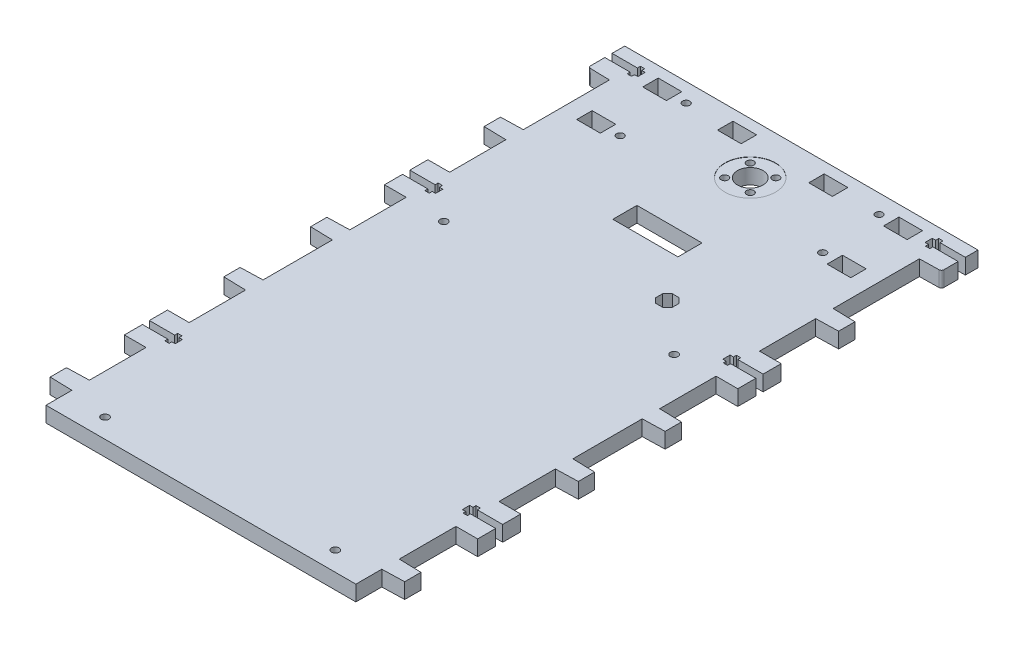
from build123d import *

# Parameters (mm, degrees)
SKETCH1_R           = 1.575
SKETCH1_R_2         = 1.5
SKETCH1_R_3         = 5.25
SKETCH1_W           = 27
SKETCH1_H           = 10
SKETCH1_W_2         = 9.8
SKETCH1_H_2         = 6.4
BOSS_EXTRUDE1_DEPTH = 6.4
SKETCH2_R           = 10.5
CUT_EXTRUDE1_DEPTH  = 0.1


with BuildPart() as part:
    # Sketch1 → Boss-Extrude1 (new body)
    with BuildSketch(Plane(origin=(0, 0, 0), x_dir=(1, 0, 0), z_dir=(0, 1, 0))):
        with BuildLine():
            Line((-8.500323666, 251.99), (138.000323666, 251.99))
            Line((138.000323666, 251.99), (138.000323666, 246.75))
            Line((138.000323666, 246.75), (127.500323666, 246.75))
            Line((127.500323666, 246.75), (127.500323666, 248))
            Line((127.500323666, 248), (125.700323666, 248))
            Line((125.700323666, 248), (125.700323666, 246.75))
            Line((125.700323666, 246.75), (124.300323666, 246.75))
            Line((124.300323666, 246.75), (124.300323666, 243.750281653))
            Line((124.300323666, 243.750281653), (125.700323666, 243.750281653))
            Line((125.700323666, 243.750281653), (125.700323666, 242.500281653))
            Line((125.700323666, 242.500281653), (127.500323666, 242.500281653))
            Line((127.500323666, 242.500281653), (127.500323666, 243.750281653))
            Line((127.500323666, 243.750281653), (138.000323666, 243.750281653))
            Line((138.000323666, 243.750281653), (138.000323666, 237.840500792))
            ThreePointArc((138.000323666, 237.840500792), (137.707887631, 237.129912233), (137, 236.830997467))
            Line((137, 236.830997467), (129, 236.670997467))
            Line((129, 236.670997467), (129, 200.950140827))
            Line((129, 200.950140827), (138.250000248, 200.700140827))
            Line((138.250000248, 200.700140827), (138.250000248, 193.950140827))
            Line((138.250000248, 193.950140827), (129, 193.700140827))
            Line((129, 193.700140827), (129, 170.369179587))
            Line((129, 170.369179587), (138, 170.369179587))
            Line((138, 170.369179587), (138, 162.868552997))
            Line((138, 162.868552997), (127.5, 162.868552997))
            Line((127.5, 162.868552997), (127.5, 164.118552997))
            Line((127.5, 164.118552997), (125.7, 164.118552997))
            Line((125.7, 164.118552997), (125.7, 162.868552997))
            Line((125.7, 162.868552997), (124.3, 162.868552997))
            Line((124.3, 162.868552997), (124.3, 159.86883465))
            Line((124.3, 159.86883465), (125.7, 159.86883465))
            Line((125.7, 159.86883465), (125.7, 158.61883465))
            Line((125.7, 158.61883465), (127.500521899, 158.61883465))
            Line((127.500521899, 158.61883465), (127.500521899, 159.86883465))
            Line((127.500521899, 159.86883465), (138.000521899, 159.86883465))
            Line((138.000521899, 159.86883465), (137.999999978, 152.368834668))
            Line((137.999999978, 152.368834668), (128.996168134, 152.36946124))
            Line((128.996168134, 152.36946124), (128.996168134, 128.994320347))
            Line((128.996168134, 128.994320347), (138.250000248, 128.744320413))
            Line((138.250000248, 128.744320413), (138.250000248, 121.994320413))
            Line((138.250000248, 121.994320413), (128.997848115, 121.744320266))
            Line((128.997848115, 121.744320266), (128.996168134, 92.994602093))
            Line((128.996168134, 92.994602093), (138.250000248, 92.744602096))
            Line((138.250000248, 92.744602096), (138.250000248, 85.994602063))
            Line((138.250000248, 85.994602063), (128.996168134, 85.744498499))
            Line((128.996168134, 85.744498499), (128.996168134, 62.369179587))
            Line((128.996168134, 62.369179587), (138, 62.369179587))
            Line((138, 62.369179587), (138, 54.869179587))
            Line((138, 54.869179587), (127.5, 54.869179587))
            Line((127.5, 54.869179587), (127.5, 56.119179587))
            Line((127.5, 56.119179587), (125.7, 56.119179587))
            Line((125.7, 56.119179587), (125.7, 54.869179587))
            Line((125.7, 54.869179587), (124.3, 54.869179587))
            Line((124.3, 54.869179587), (124.3, 51.86946124))
            Line((124.3, 51.86946124), (125.7, 51.86946124))
            Line((125.7, 51.86946124), (125.7, 50.74446124))
            Line((125.7, 50.74446124), (127.5, 50.74446124))
            Line((127.5, 50.74446124), (127.5, 51.99446124))
            Line((127.5, 51.99446124), (138, 51.99446124))
            Line((138, 51.99446124), (138, 44.49446124))
            Line((138, 44.49446124), (129, 44.49446124))
            Line((129, 44.49446124), (129, 20.99432041))
            Line((129, 20.99432041), (138.250000248, 20.74432041))
            Line((138.250000248, 20.74432041), (138.250000248, 13.99432041))
            Line((138.250000248, 13.99432041), (129, 13.74432041))
            Line((129, 13.74432041), (129, 3))
            Line((129, 3), (0.5, 3))
            Line((0.5, 3), (0.5, 13.74432041))
            Line((0.5, 13.74432041), (-8.750000248, 13.99432041))
            Line((-8.750000248, 13.99432041), (-8.750000248, 20.74432041))
            Line((-8.750000248, 20.74432041), (0.5, 20.99432041))
            Line((0.5, 20.99432041), (0.5, 44.49446124))
            Line((0.5, 44.49446124), (-8.5, 44.49446124))
            Line((-8.5, 44.49446124), (-8.5, 51.99446124))
            Line((-8.5, 51.99446124), (2, 51.99446124))
            Line((2, 51.99446124), (2, 50.74446124))
            Line((2, 50.74446124), (3.8, 50.74446124))
            Line((3.8, 50.74446124), (3.8, 51.86946124))
            Line((3.8, 51.86946124), (5.2, 51.86946124))
            Line((5.2, 51.86946124), (5.2, 54.869179587))
            Line((5.2, 54.869179587), (3.8, 54.869179587))
            Line((3.8, 54.869179587), (3.8, 56.119179587))
            Line((3.8, 56.119179587), (2, 56.119179587))
            Line((2, 56.119179587), (2, 54.869179587))
            Line((2, 54.869179587), (-8.5, 54.869179587))
            Line((-8.5, 54.869179587), (-8.5, 62.369179587))
            Line((-8.5, 62.369179587), (0.503831866, 62.369179587))
            Line((0.503831866, 62.369179587), (0.503831866, 85.744498499))
            Line((0.503831866, 85.744498499), (-8.750000248, 85.994602063))
            Line((-8.750000248, 85.994602063), (-8.750000248, 92.744602096))
            Line((-8.750000248, 92.744602096), (0.503831866, 92.994602093))
            Line((0.503831866, 92.994602093), (0.502151885, 121.744320266))
            Line((0.502151885, 121.744320266), (-8.750000248, 121.994320413))
            Line((-8.750000248, 121.994320413), (-8.750000248, 128.744320413))
            Line((-8.750000248, 128.744320413), (0.503831866, 128.994320347))
            Line((0.503831866, 128.994320347), (0.503831866, 152.36946124))
            Line((0.503831866, 152.36946124), (-8.499999978, 152.368834668))
            Line((-8.499999978, 152.368834668), (-8.500521899, 159.86883465))
            Line((-8.500521899, 159.86883465), (1.999478101, 159.86883465))
            Line((1.999478101, 159.86883465), (1.999478101, 158.61883465))
            Line((1.999478101, 158.61883465), (3.8, 158.61883465))
            Line((3.8, 158.61883465), (3.8, 159.86883465))
            Line((3.8, 159.86883465), (5.2, 159.86883465))
            Line((5.2, 159.86883465), (5.2, 162.868552997))
            Line((5.2, 162.868552997), (3.8, 162.868552997))
            Line((3.8, 162.868552997), (3.8, 164.118552997))
            Line((3.8, 164.118552997), (2, 164.118552997))
            Line((2, 164.118552997), (2, 162.868552997))
            Line((2, 162.868552997), (-8.5, 162.868552997))
            Line((-8.5, 162.868552997), (-8.5, 170.369179587))
            Line((-8.5, 170.369179587), (0.5, 170.369179587))
            Line((0.5, 170.369179587), (0.5, 193.700140827))
            Line((0.5, 193.700140827), (-8.750000248, 193.950140827))
            Line((-8.750000248, 193.950140827), (-8.750000248, 200.700140827))
            Line((-8.750000248, 200.700140827), (0.5, 200.950140827))
            Line((0.5, 200.950140827), (0.5, 236.670997467))
            Line((0.5, 236.670997467), (-7.5, 236.830997467))
            ThreePointArc((-7.5, 236.830997467), (-8.207887631, 237.129912233), (-8.500323666, 237.840500792))
            Line((-8.500323666, 237.840500792), (-8.500323666, 243.750281653))
            Line((-8.500323666, 243.750281653), (1.999676334, 243.750281653))
            Line((1.999676334, 243.750281653), (1.999676334, 242.500281653))
            Line((1.999676334, 242.500281653), (3.799676334, 242.500281653))
            Line((3.799676334, 242.500281653), (3.799676334, 243.750281653))
            Line((3.799676334, 243.750281653), (5.199676334, 243.750281653))
            Line((5.199676334, 243.750281653), (5.199676334, 246.75))
            Line((5.199676334, 246.75), (3.799676334, 246.75))
            Line((3.799676334, 246.75), (3.799676334, 248))
            Line((3.799676334, 248), (1.999676334, 248))
            Line((1.999676334, 248), (1.999676334, 246.75))
            Line((1.999676334, 246.75), (-8.500323666, 246.75))
            Line((-8.500323666, 246.75), (-8.500323666, 251.99))
        make_face()
        with Locations(Location((112.5, 10.99, 0), (0, 0, 270))):
            Circle(SKETCH1_R, mode=Mode.SUBTRACT)
        with Locations(Location((22.754421745, 218.84, 0), (0, 0, 270))):
            Circle(SKETCH1_R_2, mode=Mode.SUBTRACT)
        with Locations(Location((112.5, 151.47, 0), (0, 0, 270))):
            Circle(SKETCH1_R, mode=Mode.SUBTRACT)
        with Locations(Location((64.75, 230.79, 0), (0, 0, 270))):
            Circle(SKETCH1_R_3, mode=Mode.SUBTRACT)
        with Locations(Location((24.754421745, 244.24, 0), (0, 0, 270))):
            Circle(SKETCH1_R_2, mode=Mode.SUBTRACT)
        with Locations(Location((70.053300859, 236.093300859, 0), (0, 0, 270))):
            Circle(SKETCH1_R_2, mode=Mode.SUBTRACT)
        with Locations(Location((70.053300859, 225.486699141, 0), (0, 0, 270))):
            Circle(SKETCH1_R_2, mode=Mode.SUBTRACT)
        with Locations(Location((104.745578255, 244.24, 0), (0, 0, 270))):
            Circle(SKETCH1_R_2, mode=Mode.SUBTRACT)
        with Locations(Location((106.745578255, 218.84, 0), (0, 0, 270))):
            Circle(SKETCH1_R_2, mode=Mode.SUBTRACT)
        with Locations(Location((59.446699229, 225.486699229, 0), (0, 0, 270))):
            Circle(SKETCH1_R_2, mode=Mode.SUBTRACT)
        with Locations(Location((59.446699141, 236.093300859, 0), (0, 0, 270))):
            Circle(SKETCH1_R_2, mode=Mode.SUBTRACT)
        with Locations(Location((17, 151.47, 0), (0, 0, 270))):
            Circle(SKETCH1_R, mode=Mode.SUBTRACT)
        with Locations(Location((17, 10.99, 0), (0, 0, 270))):
            Circle(SKETCH1_R, mode=Mode.SUBTRACT)
        Polygon((93.17903679, 166.02), (95.2, 168.04096321), (95.2, 170.89903679), (93.17903679, 172.92), (90.32096321, 172.92), (88.3, 170.89903679), (88.3, 168.04096321), (90.32096321, 166.02), align=None, mode=Mode.SUBTRACT)
        with Locations((64.75, 192.31)):
            Rectangle(SKETCH1_W, SKETCH1_H, mode=Mode.SUBTRACT)
        with Locations((116.670578255, 218.84)):
            Rectangle(SKETCH1_W_2, SKETCH1_H_2, mode=Mode.SUBTRACT)
        with Locations((114.670578255, 244.24)):
            Rectangle(SKETCH1_W_2, SKETCH1_H_2, mode=Mode.SUBTRACT)
        with Locations((45.829421745, 244.24)):
            Rectangle(SKETCH1_W_2, SKETCH1_H_2, mode=Mode.SUBTRACT)
        with Locations((14.829421745, 244.24)):
            Rectangle(SKETCH1_W_2, SKETCH1_H_2, mode=Mode.SUBTRACT)
        with Locations((83.670578255, 244.24)):
            Rectangle(SKETCH1_W_2, SKETCH1_H_2, mode=Mode.SUBTRACT)
        with Locations((12.829421745, 218.84)):
            Rectangle(SKETCH1_W_2, SKETCH1_H_2, mode=Mode.SUBTRACT)
    extrude(amount=BOSS_EXTRUDE1_DEPTH)

    # Sketch2 → Cut-Extrude1 (cut)
    with BuildSketch(Plane(origin=(0, 6.4, 0), x_dir=(1, 0, 0), z_dir=(0, 1, 0))):
        with Locations(Location((64.75, 230.79, 0), (0, 0, 270))):
            Circle(SKETCH2_R)
    extrude(amount=-CUT_EXTRUDE1_DEPTH, mode=Mode.SUBTRACT)


solid = part.part
